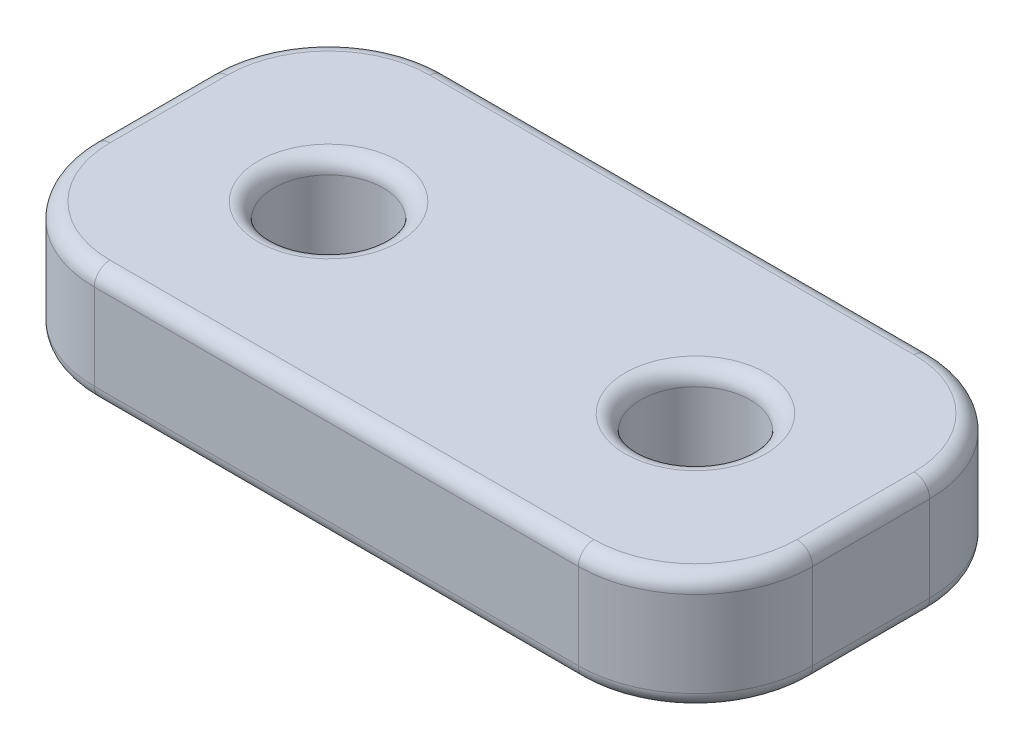
from build123d import *

# Parameters (mm, degrees)
SKETCH1_W           = 18.4
SKETCH1_H           = 9
SKETCH1_R           = 1.4
BOSS_EXTRUDE1_DEPTH = 3
FILLET2_R           = 3
FILLET3_R           = 0.4


with BuildPart() as part:
    # Sketch1 → Boss-Extrude1 (new body)
    with BuildSketch(Plane(origin=(0, 0, 0), x_dir=(1, 0, 0), z_dir=(0, 1, 0))):
        with Locations((9.2, -4.5)):
            Rectangle(SKETCH1_W, SKETCH1_H)
        with Locations(Location((4.5, -4.5, 0), (0, 0, 270))):
            Circle(SKETCH1_R, mode=Mode.SUBTRACT)
        with Locations(Location((13.9, -4.5, 0), (0, 0, 270))):
            Circle(SKETCH1_R, mode=Mode.SUBTRACT)
    extrude(amount=BOSS_EXTRUDE1_DEPTH)

    # Fillet2
    fillet2_edges = [part.edges().sort_by_distance(p)[0] for p in [
        (0, 1.5, 0),
        (18.4, 1.5, 0),
        (18.4, 1.5, 9),
        (0, 1.5, 9),
    ]]
    fillet(fillet2_edges, radius=FILLET2_R)

    # Fillet3
    fillet3_edges = [part.edges().sort_by_distance(p)[0] for p in [
        (4.5, 0, 3.1),
        (4.5, 3, 3.1),
        (13.9, 0, 3.1),
        (13.9, 3, 3.1),
        (9.2, 0, 0),
        (9.2, 3, 0),
        (0, 0, 4.5),
        (18.4, 0, 4.5),
        (9.2, 0, 9),
        (0.878679656, 0, 0.878679656),
        (0.878679656, 0, 8.121320344),
        (17.521320344, 0, 8.121320344),
        (17.521320344, 0, 0.878679656),
        (18.4, 3, 4.5),
        (0, 3, 4.5),
        (9.2, 3, 9),
        (0.878679656, 3, 0.878679656),
        (0.878679656, 3, 8.121320344),
        (17.521320344, 3, 8.121320344),
        (17.521320344, 3, 0.878679656),
    ]]
    fillet(fillet3_edges, radius=FILLET3_R)


solid = part.part
